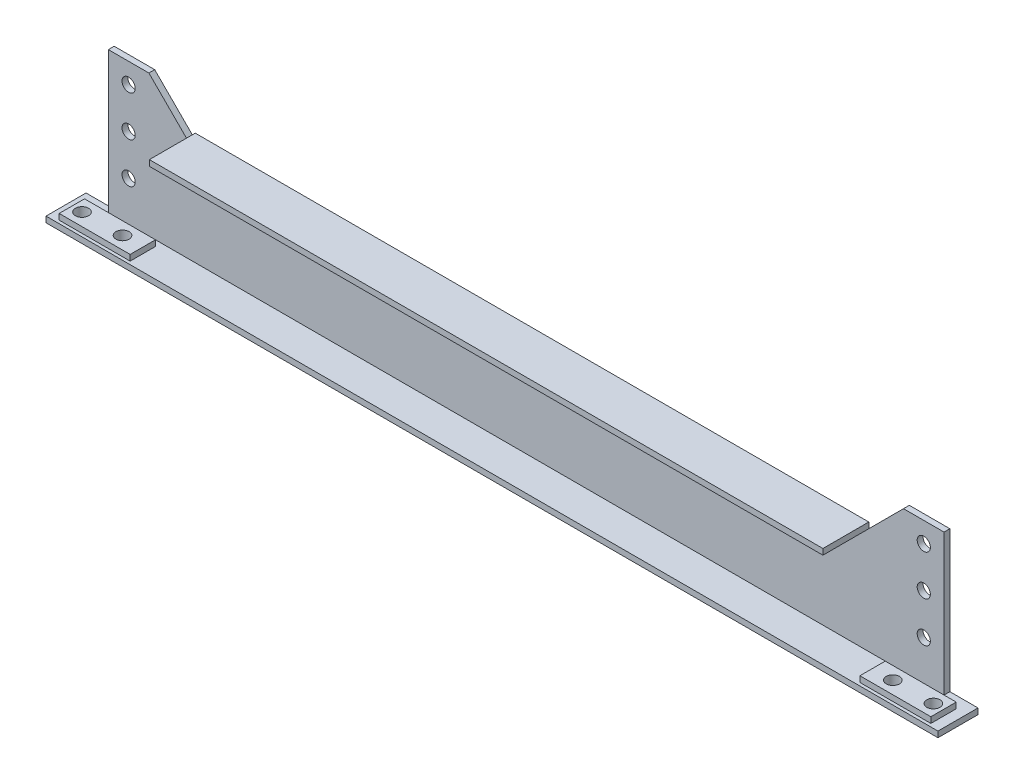
from build123d import *

# Parameters (mm, degrees)
SKETCH_1_R           = 13
EXTRUDE_586_DEPTH    = 11.5
EXTRUDE_7_DEPTH      = 79
EXTRUDE_7_DEPTH_BACK = 11.5
SKETCH_2_W           = 1329
SKETCH_2_H           = 11.5
EXTRUDE_9_DEPTH      = 67.5
EXTRUDE_9_DEPTH_BACK = 11.5
SKETCH_3_W           = 1760
SKETCH_3_H           = 11.5
SKETCH_4_W           = 140
SKETCH_4_H           = 50
EXTRUDE_10_DEPTH     = 11.5
SKETCH_6_R           = 13
CUT_EXTRUDE_1_DEPTH  = 931.962002447


with BuildPart() as part:
    # 草图1 → Extrude 586 (new body)
    with BuildSketch(Plane.XY):
        Polygon((-744.5, 139.25), (-664.5, 59.25), (664.5, 59.25), (744.5, 139.25), (824.5, 139.25), (824.5, -139.25), (-824.5, -139.25), (-824.5, 139.25), align=None)
        with Locations((-784.5, 99.25)):
            Circle(SKETCH_1_R, mode=Mode.SUBTRACT)
        with Locations((-784.5, 19.25)):
            Circle(SKETCH_1_R, mode=Mode.SUBTRACT)
        with Locations((-784.5, -60.75)):
            Circle(SKETCH_1_R, mode=Mode.SUBTRACT)
        with Locations(Location((784.5, -60.75, 0), (0, 0, 180))):
            Circle(SKETCH_1_R, mode=Mode.SUBTRACT)
        with Locations(Location((784.5, 19.25, 0), (0, 0, 180))):
            Circle(SKETCH_1_R, mode=Mode.SUBTRACT)
        with Locations(Location((784.5, 99.25, 0), (0, 0, 180))):
            Circle(SKETCH_1_R, mode=Mode.SUBTRACT)
    extrude(amount=EXTRUDE_586_DEPTH)

    # 草图2 → 凸台-拉伸7 (add, two sides: drawn at the far end of the back side and taken through both)
    with BuildSketch(Plane.XY.offset(11.5).offset(-EXTRUDE_7_DEPTH_BACK)):
        with Locations((0, 65)):
            Rectangle(SKETCH_2_W, SKETCH_2_H)
    extrude(amount=EXTRUDE_7_DEPTH + EXTRUDE_7_DEPTH_BACK)

    # 草图3 → 凸台-拉伸9 (add, two sides: drawn at the far end of the back side and taken through both)
    with BuildSketch(Plane.XY.offset(11.5).offset(-EXTRUDE_9_DEPTH_BACK)):
        with Locations((0, -145)):
            Rectangle(SKETCH_3_W, SKETCH_3_H)
    extrude(amount=EXTRUDE_9_DEPTH + EXTRUDE_9_DEPTH_BACK)

    # 草图4 → 凸台-拉伸10 (add)
    with BuildSketch(Plane(origin=(0, -139.25, 0), x_dir=(-1, 0, 0), z_dir=(0, 1, 0))):
        with Locations((-790, 48)):
            Rectangle(SKETCH_4_W, SKETCH_4_H)
        with Locations((790, 48)):
            Rectangle(SKETCH_4_W, SKETCH_4_H)
    extrude(amount=EXTRUDE_10_DEPTH)

    # 草图6 → 切除-拉伸1 (cut, through all)
    with BuildSketch(Plane.XZ.offset(150.75)):
        with Locations((-840, 48)):
            Circle(SKETCH_6_R)
        with Locations((-760, 48)):
            Circle(SKETCH_6_R)
        with Locations(Location((760, 48, 0), (0, 0, 180))):
            Circle(SKETCH_6_R)
        with Locations(Location((840, 48, 0), (0, 0, 180))):
            Circle(SKETCH_6_R)
    extrude(amount=-CUT_EXTRUDE_1_DEPTH, mode=Mode.SUBTRACT)


solid = part.part
